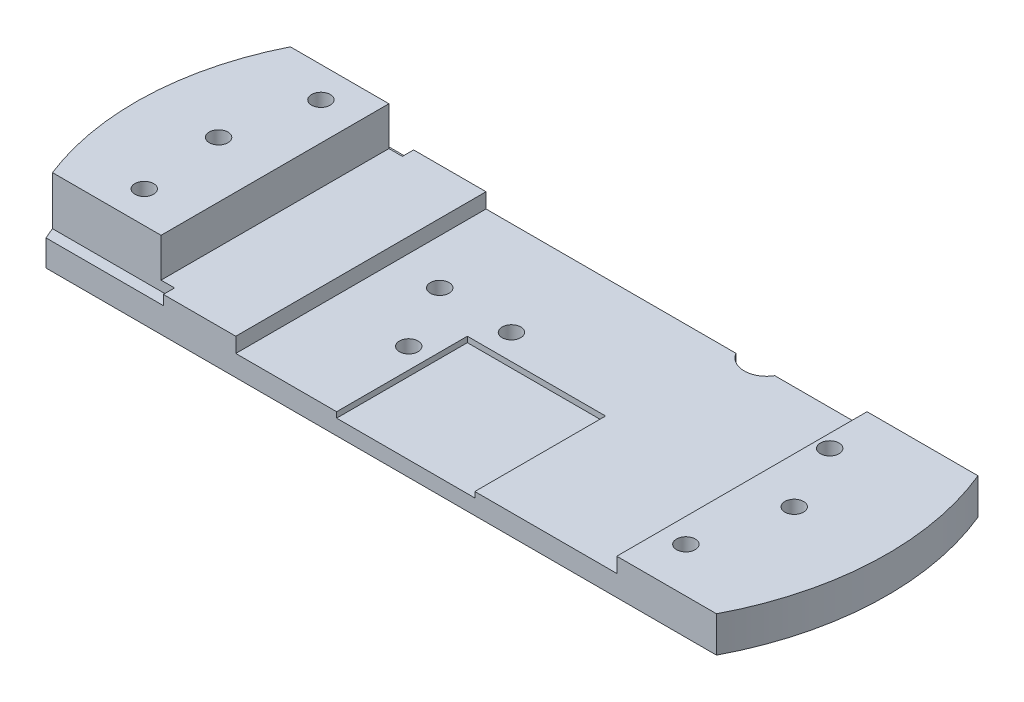
from build123d import *

# Parameters (mm, degrees)
SKETCH1_W           = 195
SKETCH1_H           = 67
BOSS_EXTRUDE1_DEPTH = 20
CUT_EXTRUDE1_DEPTH  = 20
CUT_EXTRUDE2_DEPTH  = 120.980206701
CUT_EXTRUDE3_START  = -13
SKETCH4_W           = 3.612655346
SKETCH4_H           = 3
CUT_EXTRUDE3_DEPTH  = 13
SKETCH6_R           = 2.5
CUT_EXTRUDE4_DEPTH  = 106.016665344
SKETCH7_W           = 37
SKETCH7_H           = 35
CUT_EXTRUDE5_DEPTH  = 1.5
CUT_EXTRUDE6_DEPTH  = 18.5


with BuildPart() as part:
    # Sketch1 → Boss-Extrude1 (new body)
    with BuildSketch(Plane(origin=(0, 0, 0), x_dir=(1, 0, 0), z_dir=(0, 1, 0))):
        Rectangle(SKETCH1_W, SKETCH1_H)
    extrude(amount=BOSS_EXTRUDE1_DEPTH)

    # Sketch2 → Cut-Extrude1 (cut)
    with BuildSketch(Plane.XZ):
        with BuildLine():
            Line((97.5, -3.219751644), (97.5, 33.5))
            Line((97.5, 33.5), (88.5, 33.5))
            ThreePointArc((88.5, 33.5), (95.217186872, 15.683556008), (97.5, -3.219751644))
        make_face()
        with BuildLine():
            Line((97.5, -33.5), (97.5, -3.219751644))
            ThreePointArc((97.5, -3.219751644), (95.985558513, -18.65423771), (91.5, -33.5))
            Line((91.5, -33.5), (97.5, -33.5))
        make_face()
        with BuildLine():
            ThreePointArc((-88, -33.5), (-95.08607052, -15.861694529), (-97.5, 2.992884749))
            Line((-97.5, 2.992884749), (-97.5, -33.5))
            Line((-97.5, -33.5), (-88, -33.5))
        make_face()
        with BuildLine():
            ThreePointArc((-97.5, 2.992884749), (-95.856964648, 18.588830376), (-91, 33.5))
            Line((-91, 33.5), (-97.5, 33.5))
            Line((-97.5, 33.5), (-97.5, 2.992884749))
        make_face()
    extrude(amount=-CUT_EXTRUDE1_DEPTH, mode=Mode.SUBTRACT)

    # Sketch3 → Cut-Extrude2 (cut, through all)
    with BuildSketch(Plane(origin=(0, 0, 33.5), x_dir=(-1, 0, 0), z_dir=(0, 0, -1))):
        Polygon((63.2, 20), (63.2, 9.6), (40.2, 9.6), (40.2, 5.6), (-61.8, 5.6), (-61.8, 9.6), (-97.5, 9.6), (-97.5, 20), align=None)
    extrude(amount=CUT_EXTRUDE2_DEPTH, mode=Mode.SUBTRACT)

    # Sketch4 → Cut-Extrude3 (cut)
    with BuildSketch(Plane(origin=(0, 20, 0), x_dir=(1, 0, 0), z_dir=(0, 1, 0)).offset(CUT_EXTRUDE3_START)):
        with BuildLine():
            Line((-63.2, 30.5), (-63.2, 33.5))
            Line((-63.2, 33.5), (-88, 33.5))
            ThreePointArc((-88, 33.5), (-88.810680862, 32.008999469), (-89.587344654, 30.5))
            Line((-89.587344654, 30.5), (-63.2, 30.5))
        make_face()
        with Locations((-61.393672327, 32)):
            Rectangle(SKETCH4_W, SKETCH4_H)
        with BuildLine():
            Line((-63.2, -33.5), (-63.2, -30.5))
            Line((-63.2, -30.5), (-92.261692194, -30.5))
            ThreePointArc((-92.261692194, -30.5), (-91.647155152, -32.006859002), (-91, -33.5))
            Line((-91, -33.5), (-63.2, -33.5))
        make_face()
        with Locations((-61.393672327, -32)):
            Rectangle(SKETCH4_W, SKETCH4_H)
    extrude(amount=CUT_EXTRUDE3_DEPTH, mode=Mode.SUBTRACT)

    # Sketch6 → Cut-Extrude4 (cut, through all)
    with BuildSketch(Plane.XZ):
        with Locations(Location((-28.1, -9, 0), (0, 0, 270))):
            Circle(SKETCH6_R)
        with Locations(Location((-8.2, -8.3, 0), (0, 0, 270))):
            Circle(SKETCH6_R)
        with Locations(Location((-18.7, 8.7, 0), (0, 0, 270))):
            Circle(SKETCH6_R)
        with Locations(Location((-76.2, 22, 0), (0, 0, 270))):
            Circle(SKETCH6_R)
        with Locations(Location((-78.2, 0.1, 0), (0, 0, 270))):
            Circle(SKETCH6_R)
        with Locations(Location((-73.2, -22.3, 0), (0, 0, 270))):
            Circle(SKETCH6_R)
        with Locations(Location((65.3, -20, 0), (0, 0, 270))):
            Circle(SKETCH6_R)
        with Locations(Location((74.1, -1.7, 0), (0, 0, 270))):
            Circle(SKETCH6_R)
        with Locations(Location((68.3, 21.5, 0), (0, 0, 270))):
            Circle(SKETCH6_R)
    extrude(amount=-CUT_EXTRUDE4_DEPTH, mode=Mode.SUBTRACT)

    # Sketch7 → Cut-Extrude5 (cut)
    with BuildSketch(Plane(origin=(0, 5.6, 0), x_dir=(1, 0, 0), z_dir=(0, 1, 0))):
        with Locations((5.3, -16)):
            Rectangle(SKETCH7_W, SKETCH7_H)
    extrude(amount=-CUT_EXTRUDE5_DEPTH, mode=Mode.SUBTRACT)

    # Sketch8 → Cut-Extrude6 (cut)
    with BuildSketch(Plane(origin=(0, 20, 0), x_dir=(1, 0, 0), z_dir=(0, 1, 0))):
        with BuildLine():
            Line((37.096152423, 33.5), (31.9, 33.5))
            Line((31.9, 33.5), (31.9, 30.5))
            ThreePointArc((31.9, 30.5), (34.9, 31.303847577), (37.096152423, 33.5))
        make_face()
        with BuildLine():
            Line((31.9, 33.5), (26.703847577, 33.5))
            ThreePointArc((26.703847577, 33.5), (28.9, 31.303847577), (31.9, 30.5))
            Line((31.9, 30.5), (31.9, 33.5))
        make_face()
    extrude(amount=-CUT_EXTRUDE6_DEPTH, mode=Mode.SUBTRACT)


solid = part.part
